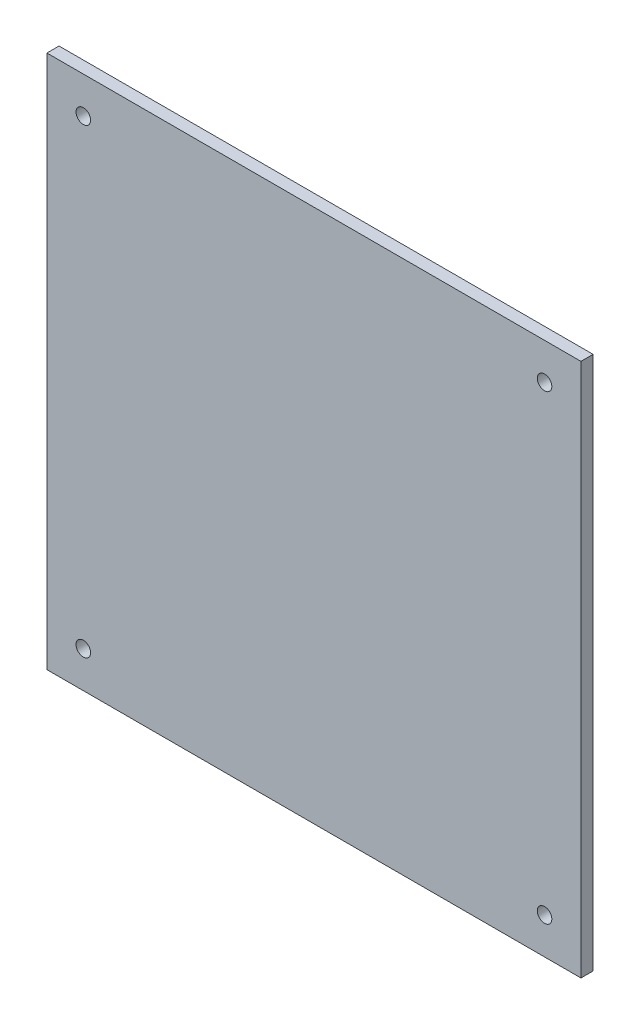
from build123d import *

# Parameters (mm, degrees)
SKETCH1_W           = 440
SKETCH1_H           = 440
SKETCH1_R           = 6
BOSS_EXTRUDE1_DEPTH = 10


with BuildPart() as part:
    # Sketch1 → Boss-Extrude1 (new body)
    with BuildSketch(Plane.XY):
        with Locations((-57.291666667, -5.902777778)):
            Rectangle(SKETCH1_W, SKETCH1_H)
        with Locations((132.708333333, 184.097222222)):
            Circle(SKETCH1_R, mode=Mode.SUBTRACT)
        with Locations((-247.291666667, 184.097222222)):
            Circle(SKETCH1_R, mode=Mode.SUBTRACT)
        with Locations((-247.291666667, -195.902777778)):
            Circle(SKETCH1_R, mode=Mode.SUBTRACT)
        with Locations((132.708333333, -195.902777778)):
            Circle(SKETCH1_R, mode=Mode.SUBTRACT)
    extrude(amount=BOSS_EXTRUDE1_DEPTH)


solid = part.part
